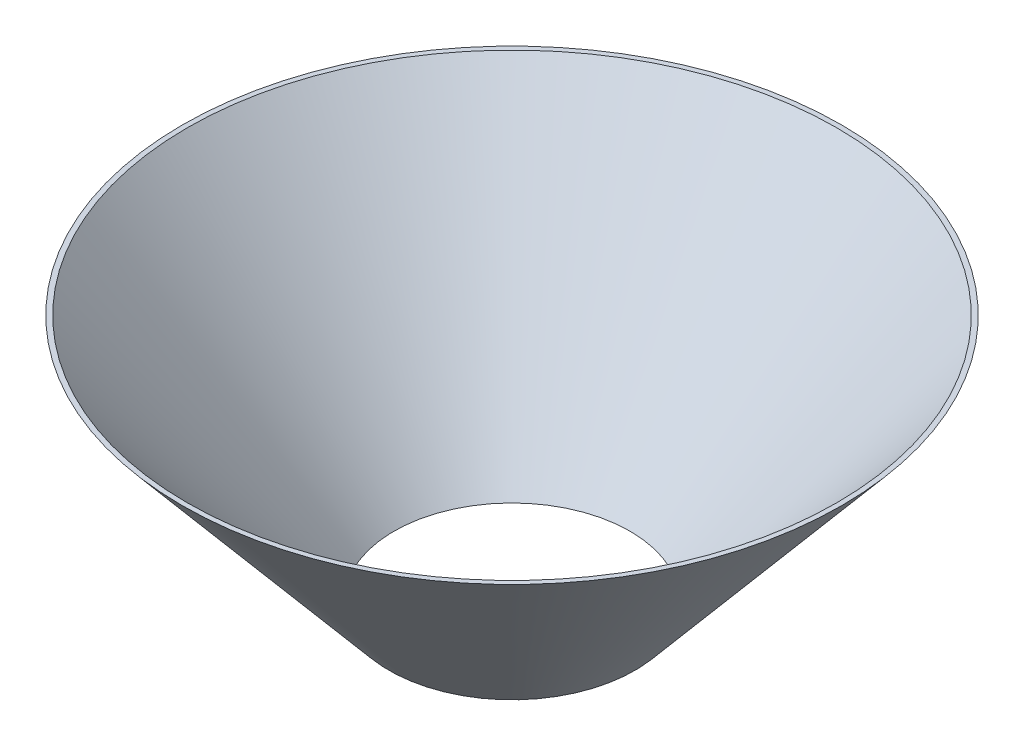
from build123d import *


with BuildPart() as part:
    # 草图1 → 旋转1 (revolve)
    with BuildSketch(Plane.XY, mode=Mode.PRIVATE) as revolve_1_sk:
        Polygon((-50, 91.899223095), (84, 91.899223095), (0, -8.100776905), (-50, -8.100776905), align=None)
    revolve(revolve_1_sk.sketch.rotate(Axis((-50, -8.100776905, 0), (0, 1, 0)), 90), axis=Axis((-50, -8.100776905, 0), (0, 1, 0)))

    # 草图2 → 切除-旋转2 (revolve, cut)
    with BuildSketch(Plane.XY, mode=Mode.PRIVATE) as cut_revolve_2_sk:
        Polygon((-50, 91.899223095), (82, 91.899223095), (-2, -8.100776905), (-50, -8.100776905), align=None)
    revolve(cut_revolve_2_sk.sketch.rotate(Axis((-50, -8.100776905, 0), (0, 1, 0)), 90), axis=Axis((-50, -8.100776905, 0), (0, 1, 0)), mode=Mode.SUBTRACT)


solid = part.part
